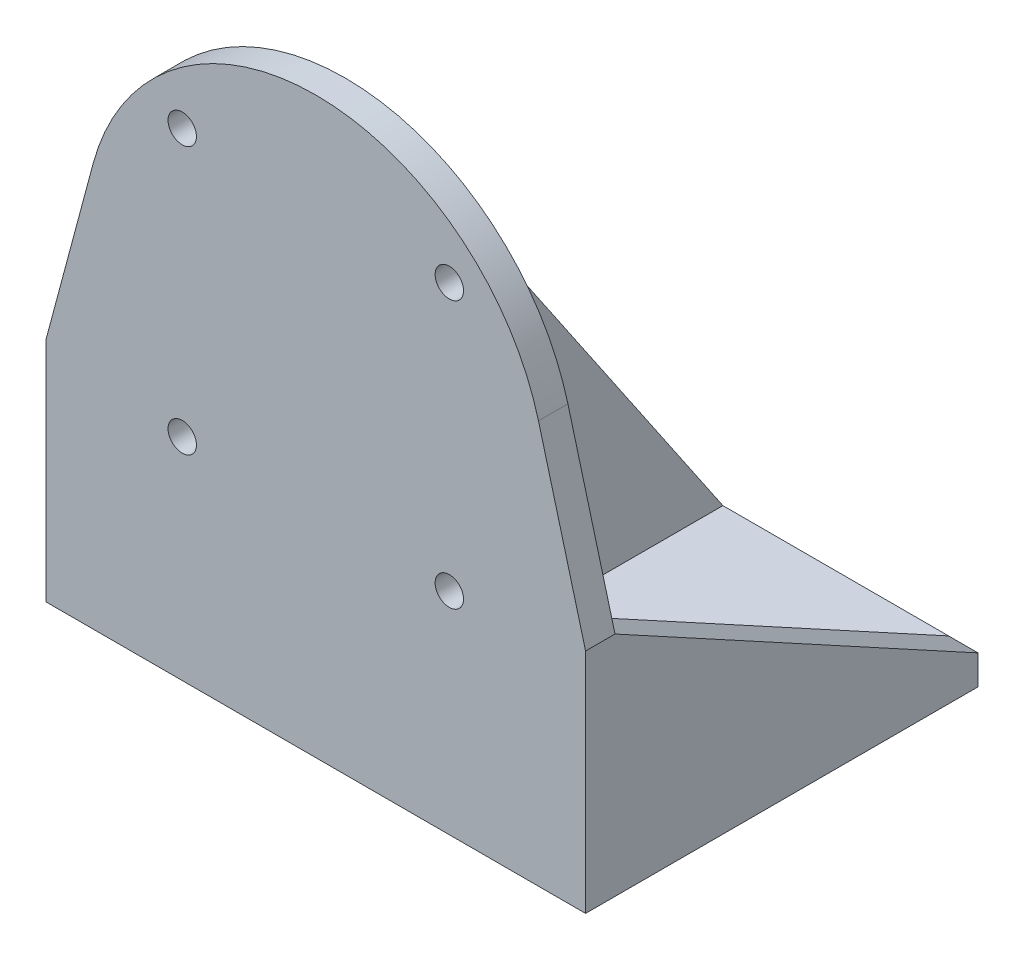
from build123d import *

# Parameters (mm, degrees)
SKETCH_1_R           = 1.447765
EXTRUDE_1_DEPTH      = 3
SKETCH_2_W           = 54.999996422
SKETCH_2_H           = 3
EXTRUDE_2_DEPTH      = 37
CUT_EXTRUDE_1_DEPTH  = 3
EXTRUDE_3_DEPTH      = 3
EXTRUDE_4_DEPTH      = 1.5
EXTRUDE_4_DEPTH_BACK = 1.5


with BuildPart() as part:
    # 草图1 → 凸台-拉伸1 (new body)
    with BuildSketch(Plane.XY):
        with BuildLine():
            Line((-13.887998211, -25.578349272), (-13.887998211, -48.743989272))
            Line((-13.887998211, -48.743989272), (41.111998211, -48.743989272))
            Line((41.111998211, -48.743989272), (41.111998211, -25.578349272))
            Line((41.111998211, -25.578349272), (36.311256918, -7.661738854))
            ThreePointArc((36.311256918, -7.661738854), (13.612, 9.756013586), (-9.087256918, -7.661738854))
            Line((-9.087256918, -7.661738854), (-13.887998211, -25.578349272))
        make_face()
        Circle(SKETCH_1_R, mode=Mode.SUBTRACT)
        with Locations((27.224, 0)):
            Circle(SKETCH_1_R, mode=Mode.SUBTRACT)
        with Locations((0, -27.224)):
            Circle(SKETCH_1_R, mode=Mode.SUBTRACT)
        with Locations((27.224, -27.224)):
            Circle(SKETCH_1_R, mode=Mode.SUBTRACT)
    extrude(amount=-EXTRUDE_1_DEPTH)

    # 草图2 → 凸台-拉伸2 (add)
    with BuildSketch(Plane(origin=(0, 0, -3), x_dir=(-1, 0, 0), z_dir=(0, 0, -1))):
        with Locations((-13.612, -47.243989272)):
            Rectangle(SKETCH_2_W, SKETCH_2_H)
    extrude(amount=EXTRUDE_2_DEPTH)

    # 草图3 → 切除-拉伸1 (cut)
    with BuildSketch(Plane(origin=(0, -45.743989272, 0), x_dir=(1, 0, 0), z_dir=(0, 1, 0))):
        with BuildLine():
            Line((32.311998211, 13), (32.311998211, 30))
            ThreePointArc((32.311998211, 30), (30.711998211, 31.6), (29.111998211, 30))
            Line((29.111998211, 30), (29.111998211, 13))
            ThreePointArc((29.111998211, 13), (30.711998211, 11.4), (32.311998211, 13))
        make_face()
        with BuildLine():
            Line((-1.887998211, 30), (-1.887998211, 13))
            ThreePointArc((-1.887998211, 13), (-3.487998211, 11.4), (-5.087998211, 13))
            Line((-5.087998211, 13), (-5.087998211, 30))
            ThreePointArc((-5.087998211, 30), (-3.487998211, 31.6), (-1.887998211, 30))
        make_face()
    extrude(amount=-CUT_EXTRUDE_1_DEPTH, mode=Mode.SUBTRACT)

    # 草图4 → 凸台-拉伸3 (add)
    with BuildSketch(Plane(origin=(41.111998211, 0, 0), x_dir=(0, 0, -1), z_dir=(1, 0, 0))):
        Polygon((40, -45.743989272), (3, -25.578345661), (3, -45.743989272), align=None)
    extrude_3 = extrude(amount=-EXTRUDE_3_DEPTH)

    # 草图13 → 凸台-拉伸4 (add, two sides: drawn at the far end of the back side and taken through both)
    with BuildSketch(Plane(origin=(13.612, 0, 0), x_dir=(0, 1, 0), z_dir=(-1, 0, 0)).offset(-EXTRUDE_4_DEPTH_BACK)):
        Polygon((-45.743989272, 40), (8.756018173, 3), (-45.743989272, 3), align=None)
    extrude(amount=EXTRUDE_4_DEPTH + EXTRUDE_4_DEPTH_BACK)

    # 镜向1: 凸台-拉伸3 across plane
    add(extrude_3.mirror(Plane.ZY.offset(-13.612)))


solid = part.part
